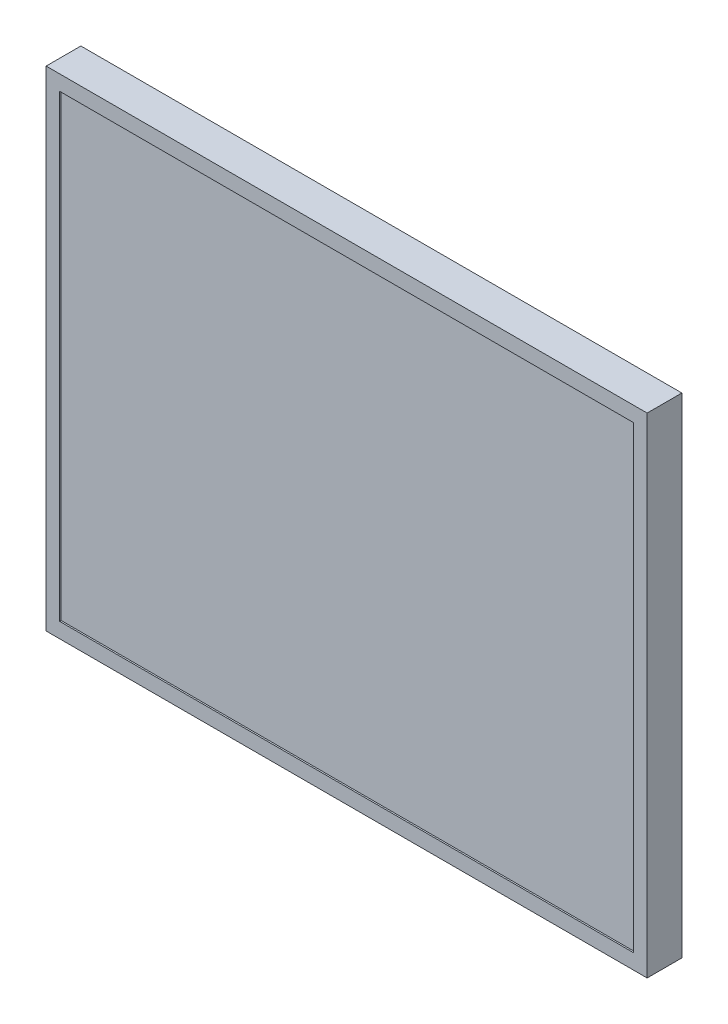
from build123d import *

# Parameters (mm, degrees)
SKETCH1_W           = 398
SKETCH1_H           = 324
BOSS_EXTRUDE1_DEPTH = 23
SKETCH2_W           = 380
SKETCH2_H           = 304
CUT_EXTRUDE1_DEPTH  = 1
SKETCH3_W           = 322
SKETCH3_H           = 162
BOSS_EXTRUDE2_DEPTH = 30
CHAMFER1_SIZE       = 20
CHAMFER1_SIZE2      = 30
SKETCH4_W           = 30
SKETCH4_H           = 10
SKETCH4_W_2         = 35
SKETCH4_H_2         = 26
BOSS_EXTRUDE3_DEPTH = 10
SKETCH5_W           = 15
SKETCH5_H           = 29
CUT_EXTRUDE2_DEPTH  = 25


with BuildPart() as part:
    # Sketch1 → Boss-Extrude1 (new body)
    with BuildSketch(Plane.XY):
        with Locations((199, 162)):
            Rectangle(SKETCH1_W, SKETCH1_H)
    extrude(amount=BOSS_EXTRUDE1_DEPTH)

    # Sketch2 → Cut-Extrude1 (cut)
    with BuildSketch(Plane.XY.offset(23)):
        with Locations((199, 162)):
            Rectangle(SKETCH2_W, SKETCH2_H)
    extrude(amount=-CUT_EXTRUDE1_DEPTH, mode=Mode.SUBTRACT)

    # Sketch3 → Boss-Extrude2 (add)
    with BuildSketch(Plane(origin=(0, 0, 0), x_dir=(-1, 0, 0), z_dir=(0, 0, -1))):
        with Locations((-213, 160)):
            Rectangle(SKETCH3_W, SKETCH3_H)
    extrude(amount=BOSS_EXTRUDE2_DEPTH)

    # Chamfer1
    chamfer1_edges = [part.edges().sort_by_distance(p)[0] for p in [
        (374, 160, -30),
    ]]
    chamfer1_side = [part.faces().sort_by_distance(p)[0] for p in [
        (374, 160, -15),
    ]]
    chamfer(chamfer1_edges, length=CHAMFER1_SIZE, length2=CHAMFER1_SIZE2, reference=chamfer1_side[0])

    # Sketch4 → Boss-Extrude3 (add)
    with BuildSketch(Plane.XZ.offset(-79)):
        with Locations((69, -15)):
            Rectangle(SKETCH4_W, SKETCH4_H)
        with Locations((116.5, -15)):
            Rectangle(SKETCH4_W_2, SKETCH4_H)
        with Locations((304, -15)):
            Rectangle(SKETCH4_W, SKETCH4_H_2)
    extrude(amount=BOSS_EXTRUDE3_DEPTH)

    # Sketch5 → Cut-Extrude2 (cut)
    with BuildSketch(Plane(origin=(0, 0, -30), x_dir=(-1, 0, 0), z_dir=(0, 0, -1))):
        with Locations((-59.5, 120.5)):
            Rectangle(SKETCH5_W, SKETCH5_H)
    extrude(amount=-CUT_EXTRUDE2_DEPTH, mode=Mode.SUBTRACT)


solid = part.part
